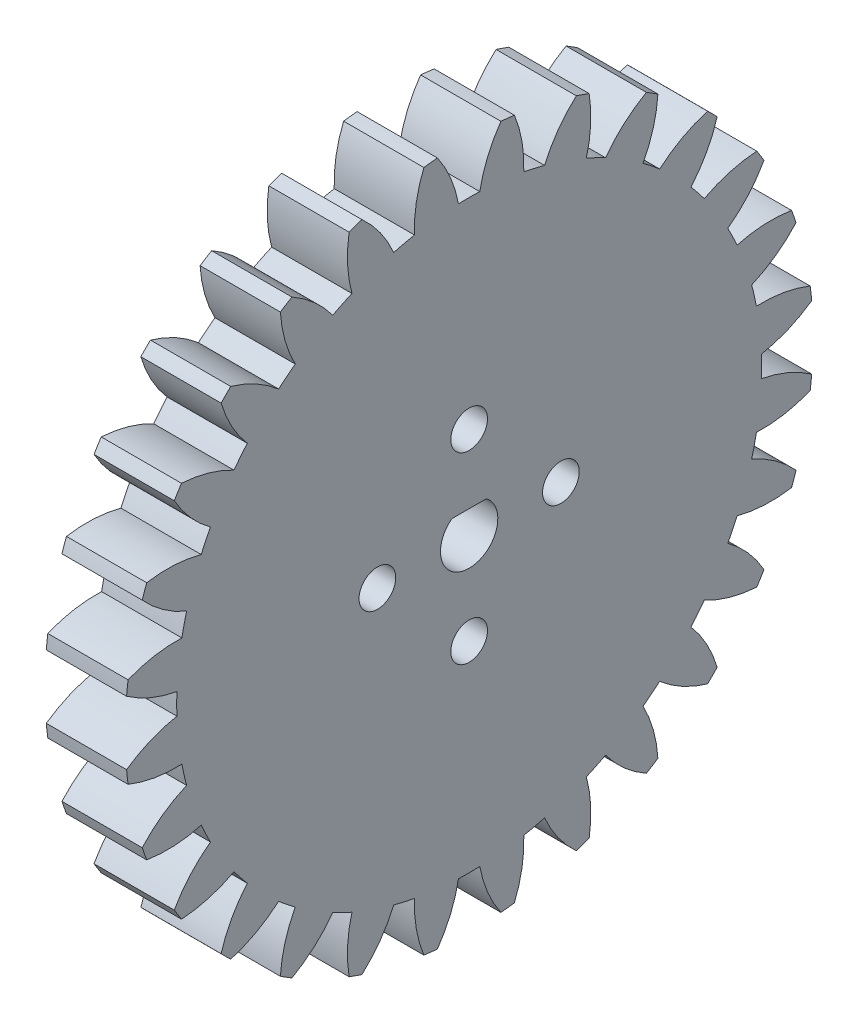
from build123d import *

# Parameters (mm, degrees)
BASPROSKE_W              = 7
BASPROSKE_H              = 30
TOOTHCUT_DEPTH           = 44
TEETHCUTS_COUNT          = 28
TEETHCUTS_ANGLE          = 347.142857143
BORSKE_R                 = 0.1
BORE_DEPTH               = 50.0000508
TAGLIO_ESTRUSIONE1_DEPTH = 30
SCHIZZO2_R               = 1.6
TAGLIO_ESTRUSIONE2_DEPTH = 10


with BuildPart() as part:
    # BasProSke → Base-Revolve (revolve)
    with BuildSketch(Plane(origin=(0, 0, 0), x_dir=(1, 0, 0), z_dir=(0, 1, 0)), mode=Mode.PRIVATE) as base_revolve_sk:
        with Locations((3.5, 15)):
            Rectangle(BASPROSKE_W, BASPROSKE_H)
    revolve(base_revolve_sk.sketch.rotate(Axis((-10, 0, 0), (1, 0, 0)), 180), axis=Axis((-10, 0, 0), (1, 0, 0)))

    # TooCutSke → ToothCut (cut, through all)
    with BuildSketch(Plane(origin=(0, 0, 0), x_dir=(0, 0, -1), z_dir=(1, 0, 0))):
        with BuildLine():
            ThreePointArc((0.928503763, 25.482089431), (0, 25.499), (-0.928503763, 25.482089431))
            ThreePointArc((-0.928503763, 25.482089431), (-1.618524429, 27.789411612), (-2.78585155, 29.895880591))
            ThreePointArc((-2.78585155, 29.895880591), (0, 30.0254), (2.78585155, 29.895880591))
            ThreePointArc((2.78585155, 29.895880591), (1.618524429, 27.789411612), (0.928503763, 25.482089431))
        make_face()
    toothcut = extrude(amount=TOOTHCUT_DEPTH, mode=Mode.SUBTRACT)

    # TeethCuts: ToothCut ×28 about axis
    teethcuts_axis = Axis((-10, 0, 0), (1, 0, 0))
    for i in range(1, TEETHCUTS_COUNT):
        add(toothcut.rotate(teethcuts_axis, i * TEETHCUTS_ANGLE / (TEETHCUTS_COUNT - 1)), mode=Mode.SUBTRACT)

    # BorSke → Bore (cut, symmetric)
    with BuildSketch(Plane(origin=(0, 0, 0), x_dir=(0, 0, -1), z_dir=(1, 0, 0))):
        with Locations(Location((0, 0, 0), (0, 0, 180))):
            Circle(BORSKE_R)
    extrude(amount=BORE_DEPTH, both=True, mode=Mode.SUBTRACT)

    # Schizzo1 → Taglio-Estrusione1 (cut)
    with BuildSketch(Plane(origin=(7, 0, 0), x_dir=(0, 0, -1), z_dir=(1, 0, 0))):
        with BuildLine():
            Line((-1.5, 2), (1.5, 2))
            ThreePointArc((1.5, 2), (0, -2.5), (-1.5, 2))
        make_face()
    extrude(amount=-TAGLIO_ESTRUSIONE1_DEPTH, mode=Mode.SUBTRACT)

    # Schizzo2 → Taglio-Estrusione2 (cut)
    with BuildSketch(Plane.ZY):
        with Locations((0, 8)):
            Circle(SCHIZZO2_R)
        with Locations((8, 0)):
            Circle(SCHIZZO2_R)
        with Locations((0, -8)):
            Circle(SCHIZZO2_R)
        with Locations((-8, 0)):
            Circle(SCHIZZO2_R)
    extrude(amount=-TAGLIO_ESTRUSIONE2_DEPTH, mode=Mode.SUBTRACT)


solid = part.part
